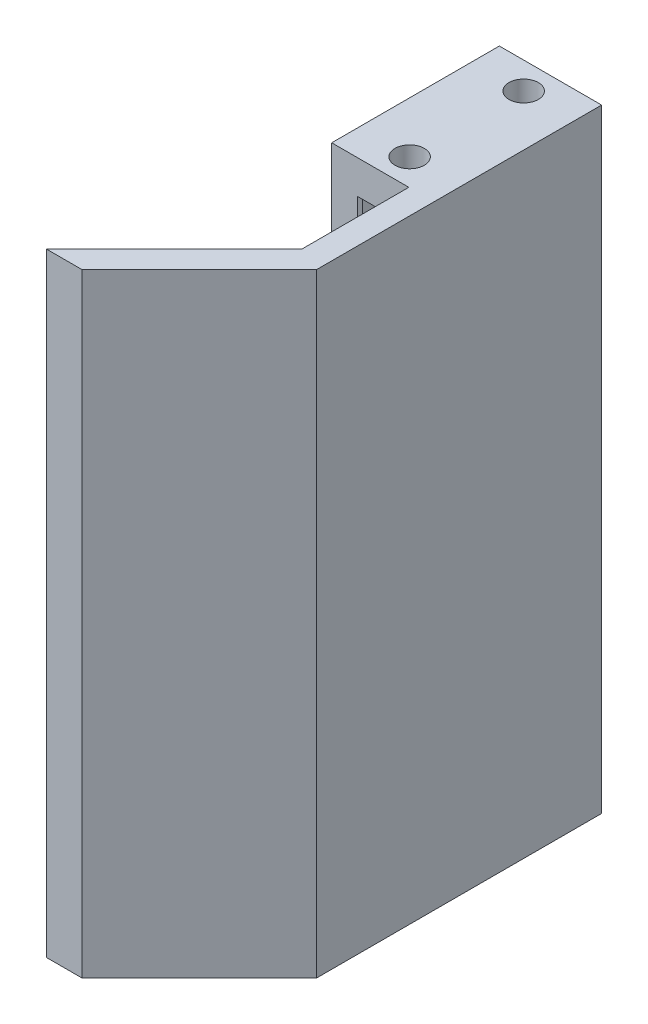
from build123d import *

# Parameters (mm, degrees)
EXTRUDE_1_DEPTH     = 73.2
SKETCH_2_W          = 9.2
SKETCH_2_H          = 20
EXTRUDE_2_DEPTH     = 12
SKETCH_4_R          = 1.75
CUT_EXTRUDE_1_DEPTH = 20
SKETCH_7_W          = 5.45
SKETCH_7_H          = 6.4
SKETCH_7_W_2        = 5.35
CUT_EXTRUDE_2_DEPTH = 5
CHAMFER_1_SIZE      = 0.3


with BuildPart() as part:
    # 草图1 → 凸台-拉伸1 (new body)
    with BuildSketch(Plane(origin=(0, 0, 0), x_dir=(1, 0, 0), z_dir=(0, 1, 0))):
        Polygon((-12.5, -31), (1.5, -17), (1.5, 17), (-1.5, 17), (-1.5, -15.757359313), (-16.742640687, -31), align=None)
    extrude(amount=EXTRUDE_1_DEPTH)

    # 草图2 → 凸台-拉伸2 (add)
    with BuildSketch(Plane(origin=(0, 73.2, 0), x_dir=(1, 0, 0), z_dir=(0, 1, 0))):
        with Locations((-6.1, 7)):
            Rectangle(SKETCH_2_W, SKETCH_2_H)
    extrude_2 = extrude(amount=-EXTRUDE_2_DEPTH)

    # 草图4 → 切除-拉伸1 (cut)
    with BuildSketch(Plane(origin=(0, 73.2, 0), x_dir=(1, 0, 0), z_dir=(0, 1, 0))):
        with Locations(Location((-4.6, 13.8, 0), (0, 0, 270))):
            Circle(SKETCH_4_R)
        with Locations(Location((-4.6, 0.2, 0), (0, 0, 90))):
            Circle(SKETCH_4_R)
    cut_extrude_1 = extrude(amount=-CUT_EXTRUDE_1_DEPTH, mode=Mode.SUBTRACT)

    # 草图7 → 切除-拉伸2 (cut)
    with BuildSketch(Plane(origin=(0, 69.2, 0), x_dir=(1, 0, 0), z_dir=(0, 1, 0))):
        with Locations((-4.6, 0.2)):
            Rectangle(SKETCH_7_W, SKETCH_7_H)
        with Locations((-4.55, 13.8)):
            Rectangle(SKETCH_7_W_2, SKETCH_7_H)
    cut_extrude_2 = extrude(amount=-CUT_EXTRUDE_2_DEPTH, mode=Mode.SUBTRACT)

    # 镜向1: 凸台-拉伸2, 切除-拉伸1, 切除-拉伸2 across plane
    add(extrude_2.mirror(Plane.ZX.offset(36.6)))
    add(cut_extrude_1.mirror(Plane.ZX.offset(36.6)), mode=Mode.SUBTRACT)
    add(cut_extrude_2.mirror(Plane.ZX.offset(36.6)), mode=Mode.SUBTRACT)

    # 倒角1
    chamfer_1_edges = [part.edges().sort_by_distance(p)[0] for p in [
        (-7.325, 6.5, 3),
        (-1.875, 6.5, 3),
        (-7.225, 6.5, -17),
        (-1.875, 6.5, -17),
        (-7.325, 66.7, 3),
        (-1.875, 66.7, 3),
        (-7.225, 66.7, -17),
        (-1.875, 66.7, -17),
    ]]
    chamfer(chamfer_1_edges, length=CHAMFER_1_SIZE)


solid = part.part
